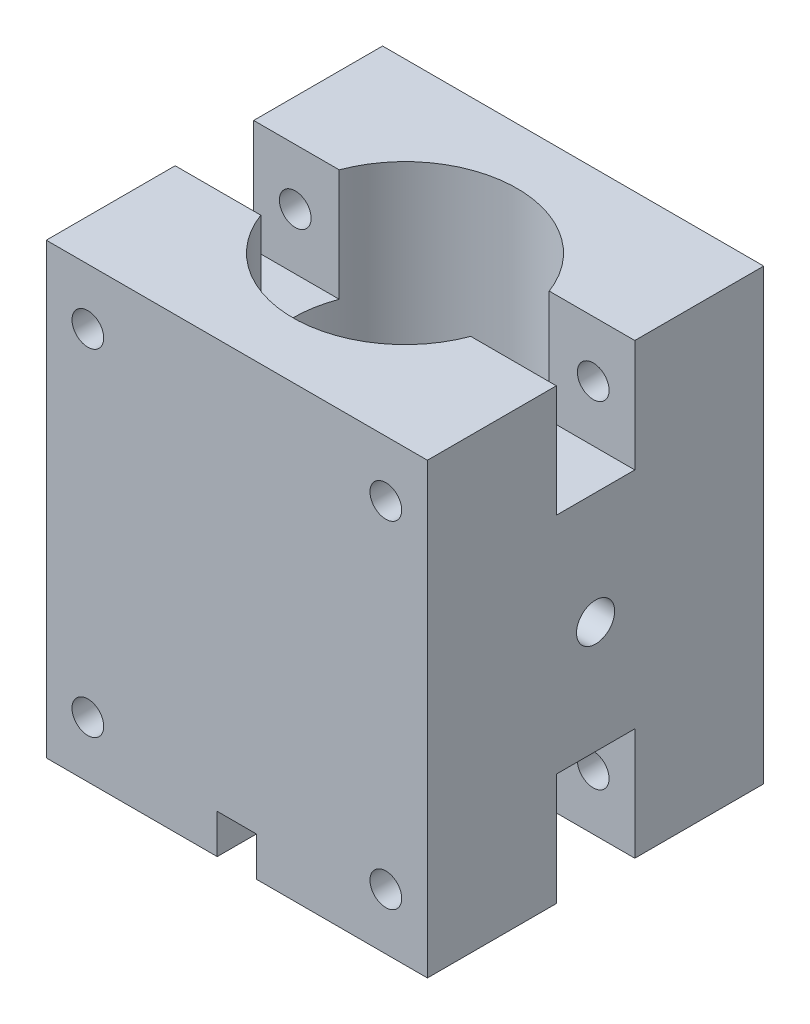
from build123d import *

# Parameters (mm, degrees)
SKETCH1_R                       = 20
BOSS_EXTRUDE1_DEPTH             = 40
SKETCH26_W                      = 15.7
SKETCH26_H                      = 14
CUT_EXTRUDE19_DEPTH             = 20
SKETCH30_W                      = 92.939365228
SKETCH30_H                      = 14
CUT_EXTRUDE22_DEPTH             = 20
CUT_EXTRUDE20_REACH             = 62.465
SKETCH27_R                      = 2.830219018
CUT_EXTRUDE20_DIRECTION_2_REACH = 62.465
CUT_EXTRUDE24_START             = -20
SKETCH33_R                      = 3.4
CUT_EXTRUDE24_DEPTH             = 50
SKETCH37_W                      = 7
SKETCH37_H                      = 70.017745432
CUT_EXTRUDE26_DEPTH             = 7


with BuildPart() as part:
    # Sketch1 → Boss-Extrude1 (new, symmetric)
    with BuildSketch(Plane(origin=(0, 0, 0), x_dir=(1, 0, 0), z_dir=(0, 1, 0))):
        Polygon((-20, -30), (34, -30), (34, 30), (-20, 30), (-34, 30), (-34, -30), align=None)
        Circle(SKETCH1_R, mode=Mode.SUBTRACT)
    extrude(amount=BOSS_EXTRUDE1_DEPTH, both=True)

    # Sketch26 → Cut-Extrude19 (cut)
    with BuildSketch(Plane(origin=(0, 40, 0), x_dir=(1, 0, 0), z_dir=(0, 1, 0))):
        with Locations((26.584993995, 0)):
            Rectangle(SKETCH26_W, SKETCH26_H)
        with BuildLine():
            Line((-34.434993995, -7), (-18.734993995, -7))
            ThreePointArc((-18.734993995, -7), (-20, 0), (-18.734993995, 7))
            Line((-18.734993995, 7), (-34.434993995, 7))
            Line((-34.434993995, 7), (-34.434993995, -7))
        make_face()
    extrude(amount=-CUT_EXTRUDE19_DEPTH, mode=Mode.SUBTRACT)

    # Sketch30 → Cut-Extrude22 (cut)
    with BuildSketch(Plane.XZ.offset(40)):
        Rectangle(SKETCH30_W, SKETCH30_H)
    extrude(amount=-CUT_EXTRUDE22_DEPTH, mode=Mode.SUBTRACT)

    # Cut-Extrude20: up to this face of the body (flat: up to its plane)
    cut_extrude20_end = Plane(part.part.faces().sort_by_distance((0, 0, 30))[0])
    # Sketch27 → Cut-Extrude20 (cut, up to the picked face)
    with BuildSketch(Plane(origin=(0, 0, 0), x_dir=(-1, 0, 0), z_dir=(0, 0, -1)), mode=Mode.PRIVATE) as cut_extrude20_sk1:
        with Locations((26.58, 30)):
            Circle(SKETCH27_R)
    cut_extrude20_tool1 = split(extrude(cut_extrude20_sk1.sketch, amount=-CUT_EXTRUDE20_REACH, mode=Mode.PRIVATE), bisect_by=cut_extrude20_end, keep=Keep.BOTH, mode=Mode.PRIVATE)
    # Sketch27 → Cut-Extrude20 (cut, up to the picked face)
    with BuildSketch(Plane(origin=(0, 0, 0), x_dir=(-1, 0, 0), z_dir=(0, 0, -1)), mode=Mode.PRIVATE) as cut_extrude20_sk2:
        with Locations((-26.58, 30)):
            Circle(SKETCH27_R)
    cut_extrude20_tool2 = split(extrude(cut_extrude20_sk2.sketch, amount=-CUT_EXTRUDE20_REACH, mode=Mode.PRIVATE), bisect_by=cut_extrude20_end, keep=Keep.BOTH, mode=Mode.PRIVATE)
    cut_extrude20_1 = cut_extrude20_tool1.solids().sort_by(Axis((-26.58, 30, 0), (0, 0, 1)))[0]
    add(cut_extrude20_1, mode=Mode.SUBTRACT)
    cut_extrude20_2 = cut_extrude20_tool2.solids().sort_by(Axis((26.58, 30, 0), (0, 0, 1)))[0]
    add(cut_extrude20_2, mode=Mode.SUBTRACT)
    cut_extrude20 = cut_extrude20_1 + cut_extrude20_2  # Cut-Extrude20 as one shape, for the pattern or mirror that repeats it

    # Cut-Extrude20 direction 2: up to this face of the body (flat: up to its plane)
    cut_extrude20_direction_2_end = Plane(part.part.faces().sort_by_distance((0, 0, -30))[0])
    # Sketch27 → Cut-Extrude20 direction 2 (cut, up to the picked face)
    with BuildSketch(Plane(origin=(0, 0, 0), x_dir=(-1, 0, 0), z_dir=(0, 0, -1)), mode=Mode.PRIVATE) as cut_extrude20_direction_2_sk1:
        with Locations((26.58, 30)):
            Circle(SKETCH27_R)
    cut_extrude20_direction_2_tool1 = split(extrude(cut_extrude20_direction_2_sk1.sketch, amount=CUT_EXTRUDE20_DIRECTION_2_REACH, mode=Mode.PRIVATE), bisect_by=cut_extrude20_direction_2_end, keep=Keep.BOTH, mode=Mode.PRIVATE)
    # Sketch27 → Cut-Extrude20 direction 2 (cut, up to the picked face)
    with BuildSketch(Plane(origin=(0, 0, 0), x_dir=(-1, 0, 0), z_dir=(0, 0, -1)), mode=Mode.PRIVATE) as cut_extrude20_direction_2_sk2:
        with Locations((-26.58, 30)):
            Circle(SKETCH27_R)
    cut_extrude20_direction_2_tool2 = split(extrude(cut_extrude20_direction_2_sk2.sketch, amount=CUT_EXTRUDE20_DIRECTION_2_REACH, mode=Mode.PRIVATE), bisect_by=cut_extrude20_direction_2_end, keep=Keep.BOTH, mode=Mode.PRIVATE)
    cut_extrude20_direction_2_1 = cut_extrude20_direction_2_tool1.solids().sort_by(Axis((-26.58, 30, 0), (0, 0, -1)))[0]
    add(cut_extrude20_direction_2_1, mode=Mode.SUBTRACT)
    cut_extrude20_direction_2_2 = cut_extrude20_direction_2_tool2.solids().sort_by(Axis((26.58, 30, 0), (0, 0, -1)))[0]
    add(cut_extrude20_direction_2_2, mode=Mode.SUBTRACT)
    cut_extrude20_direction_2 = cut_extrude20_direction_2_1 + cut_extrude20_direction_2_2  # Cut-Extrude20 direction 2 as one shape, for the pattern or mirror that repeats it

    # Mirror1: Cut-Extrude20, Cut-Extrude20 direction 2 across plane
    add(cut_extrude20.mirror(Plane.ZX), mode=Mode.SUBTRACT)
    add(cut_extrude20_direction_2.mirror(Plane.ZX), mode=Mode.SUBTRACT)

    # Sketch33 → Cut-Extrude24 (cut)
    with BuildSketch(Plane.ZY.offset(34).offset(CUT_EXTRUDE24_START)):
        Circle(SKETCH33_R)
    cut_extrude24 = extrude(amount=CUT_EXTRUDE24_DEPTH, mode=Mode.SUBTRACT)

    # Mirror6: Cut-Extrude24 across plane
    add(cut_extrude24.mirror(Plane(origin=(0, 0, 0), x_dir=(0, 0, 1), z_dir=(1, 0, 0))), mode=Mode.SUBTRACT)

    # Sketch37 → Cut-Extrude26 (cut)
    with BuildSketch(Plane.XZ.offset(40)):
        Rectangle(SKETCH37_W, SKETCH37_H)
    extrude(amount=-CUT_EXTRUDE26_DEPTH, mode=Mode.SUBTRACT)


solid = part.part
